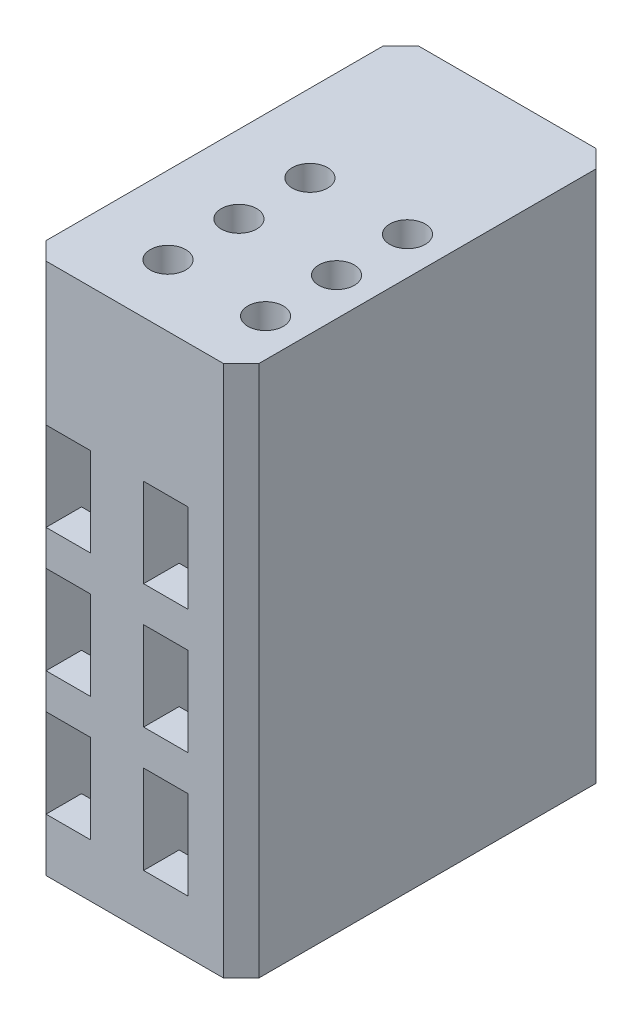
from build123d import *

# Parameters (mm, degrees)
EXTRUDE_1_DEPTH                  = 30
SKETCH_2_W                       = 4.5
SKETCH_2_H                       = 17
SKETCH_2_R                       = 1
EXTRUDE_2_DEPTH                  = 3
EXTRUDE_3_DEPTH                  = 27
PATTERN_LINEAR_1_COUNT           = 2
PATTERN_LINEAR_1_PITCH           = 5.5
PATTERN_LINEAR_2_COUNT           = 2
PATTERN_LINEAR_2_PITCH           = 5.5
CUT_EXTRUDE_1_REACH              = 39.108
SKETCH_5_W                       = 2.5
SKETCH_5_H                       = 3
PATTERN_LINEAR_3_COUNT           = 3
PATTERN_LINEAR_3_PITCH           = 7
PATTERN_LINEAR_4_COUNT           = 2
PATTERN_LINEAR_4_PITCH           = 5.5
PATTERN_LINEAR_4_COPY_1_REACH    = 39.108
PATTERN_LINEAR_4_COPY_1_SKETCH_W = 2.5
PATTERN_LINEAR_4_COPY_1_SKETCH_H = 3
PATTERN_LINEAR_4_COPY_2_REACH    = 39.108
PATTERN_LINEAR_4_COPY_2_SKETCH_W = 2.5
PATTERN_LINEAR_4_COPY_2_SKETCH_H = 3
CUT_EXTRUDE_2_REACH              = 39.108
SKETCH_6_W                       = 2.5
SKETCH_6_H                       = 5
PATTERN_LINEAR_5_COUNT           = 3
PATTERN_LINEAR_5_PITCH           = 7
PATTERN_LINEAR_7_COUNT           = 2
PATTERN_LINEAR_7_PITCH           = 5.5
PATTERN_LINEAR_7_COPY_1_REACH    = 39.108
PATTERN_LINEAR_7_COPY_1_SKETCH_W = 2.5
PATTERN_LINEAR_7_COPY_1_SKETCH_H = 5
PATTERN_LINEAR_7_COPY_2_REACH    = 39.108
PATTERN_LINEAR_7_COPY_2_SKETCH_W = 2.5
PATTERN_LINEAR_7_COPY_2_SKETCH_H = 5


with BuildPart() as part:
    # Эскиз1 → Бобышка-Вытянуть1 (new body)
    with BuildSketch(Plane(origin=(0, 0, 0), x_dir=(1, 0, 0), z_dir=(0, 1, 0))):
        Polygon((5, 0), (-5, 0), (-6, 1), (-6, 10.5), (-5, 10.5), (-5, 2), (-0.5, 2), (-0.5, 10.5), (0.5, 10.5), (0.5, 2), (5, 2), (5, 10.5), (6, 10.5), (6, 1), align=None)
    extrude_1 = extrude(amount=EXTRUDE_1_DEPTH)

    # Зеркальное отражение1: Бобышка-Вытянуть1 across plane
    add(extrude_1.mirror(Plane(origin=(-0.5, 30, -10.5), x_dir=(1, 0, 0), z_dir=(0, 0, 1))))

    # Эскиз2 → Бобышка-Вытянуть2 (add)
    with BuildSketch(Plane(origin=(0, 30, 0), x_dir=(1, 0, 0), z_dir=(0, 1, 0))):
        with Locations((-2.75, 10.5)):
            Rectangle(SKETCH_2_W, SKETCH_2_H)
        with Locations(Location((-1.625, 11.5, 0), (0, 0, 270))):
            Circle(SKETCH_2_R, mode=Mode.SUBTRACT)
        with Locations(Location((-1.625, 7.5, 0), (0, 0, 270))):
            Circle(SKETCH_2_R, mode=Mode.SUBTRACT)
        with Locations(Location((-1.625, 3.5, 0), (0, 0, 270))):
            Circle(SKETCH_2_R, mode=Mode.SUBTRACT)
    extrude_2 = extrude(amount=-EXTRUDE_2_DEPTH)

    # Эскиз3 → Бобышка-Вытянуть3 (add)
    with BuildSketch(Plane.XZ.offset(-27)):
        Polygon((-2.5, -19), (-0.5, -19), (-0.5, -13), (-1.625, -13), (-2.5, -13), align=None)
        Polygon((-1.625, -10), (-0.5, -10), (-0.5, -9), (-1.625, -9), (-2.5, -9), (-2.5, -10), align=None)
        Polygon((-1.625, -6), (-0.5, -6), (-0.5, -5), (-2.5, -5), (-2.5, -6), align=None)
    extrude_3 = extrude(amount=EXTRUDE_3_DEPTH)

    # Линейный массив1: Бобышка-Вытянуть2 ×2
    with Locations(*[(i * PATTERN_LINEAR_1_PITCH, 0, 0) for i in range(1, PATTERN_LINEAR_1_COUNT)]):
        add(extrude_2)

    # Линейный массив2: Бобышка-Вытянуть3 ×2
    with Locations(*[(i * PATTERN_LINEAR_2_PITCH, 0, 0) for i in range(1, PATTERN_LINEAR_2_COUNT)]):
        add(extrude_3)

    # Эскиз5 → Вырез-Вытянуть1 (cut, up to next)
    with BuildSketch(Plane(origin=(0, 0, -21), x_dir=(-1, 0, 0), z_dir=(0, 0, -1)), mode=Mode.PRIVATE) as cut_extrude_1_sk1:
        with Locations((3.75, 18.5)):
            Rectangle(SKETCH_5_W, SKETCH_5_H)
    cut_extrude_1_tool1 = extrude(cut_extrude_1_sk1.sketch, amount=-CUT_EXTRUDE_1_REACH, mode=Mode.PRIVATE) & part.part
    cut_extrude_1 = cut_extrude_1_tool1.solids().sort_by_distance((-3.75, 18.5, -21))[0]
    add(cut_extrude_1, mode=Mode.SUBTRACT)

    # Линейный массив3: Вырез-Вытянуть1 ×3
    with Locations(*[(0, -i * PATTERN_LINEAR_3_PITCH, 0) for i in range(1, PATTERN_LINEAR_3_COUNT)]):
        add(cut_extrude_1, mode=Mode.SUBTRACT)

    # Линейный массив4: Вырез-Вытянуть1 ×2
    with Locations(*[(i * PATTERN_LINEAR_4_PITCH, 0, 0) for i in range(1, PATTERN_LINEAR_4_COUNT)]):
        add(cut_extrude_1, mode=Mode.SUBTRACT)

    # Линейный массив4 copy 1 sketch → Линейный массив4 copy 1 (cut, up to next)
    with BuildSketch(Plane(origin=(5.5, -7, -21), x_dir=(-1, 0, 0), z_dir=(0, 0, -1)), mode=Mode.PRIVATE) as pattern_linear_4_copy_1_sk1:
        with Locations((3.75, 18.5)):
            Rectangle(PATTERN_LINEAR_4_COPY_1_SKETCH_W, PATTERN_LINEAR_4_COPY_1_SKETCH_H)
    pattern_linear_4_copy_1_tool1 = extrude(pattern_linear_4_copy_1_sk1.sketch, amount=-PATTERN_LINEAR_4_COPY_1_REACH, mode=Mode.PRIVATE) & part.part
    add(pattern_linear_4_copy_1_tool1.solids().sort_by_distance((1.75, 11.5, -21))[0], mode=Mode.SUBTRACT)

    # Линейный массив4 copy 2 sketch → Линейный массив4 copy 2 (cut, up to next)
    with BuildSketch(Plane(origin=(5.5, -14, -21), x_dir=(-1, 0, 0), z_dir=(0, 0, -1)), mode=Mode.PRIVATE) as pattern_linear_4_copy_2_sk1:
        with Locations((3.75, 18.5)):
            Rectangle(PATTERN_LINEAR_4_COPY_2_SKETCH_W, PATTERN_LINEAR_4_COPY_2_SKETCH_H)
    pattern_linear_4_copy_2_tool1 = extrude(pattern_linear_4_copy_2_sk1.sketch, amount=-PATTERN_LINEAR_4_COPY_2_REACH, mode=Mode.PRIVATE) & part.part
    add(pattern_linear_4_copy_2_tool1.solids().sort_by_distance((1.75, 4.5, -21))[0], mode=Mode.SUBTRACT)

    # Эскиз6 → Вырез-Вытянуть2 (cut, up to next)
    with BuildSketch(Plane.XY, mode=Mode.PRIVATE) as cut_extrude_2_sk1:
        with Locations((-3.75, 19.5)):
            Rectangle(SKETCH_6_W, SKETCH_6_H)
    cut_extrude_2_tool1 = extrude(cut_extrude_2_sk1.sketch, amount=-CUT_EXTRUDE_2_REACH, mode=Mode.PRIVATE) & part.part
    cut_extrude_2 = cut_extrude_2_tool1.solids().sort_by_distance((-3.75, 19.5, 0))[0]
    add(cut_extrude_2, mode=Mode.SUBTRACT)

    # Линейный массив5: Вырез-Вытянуть2 ×3
    with Locations(*[(0, -i * PATTERN_LINEAR_5_PITCH, 0) for i in range(1, PATTERN_LINEAR_5_COUNT)]):
        add(cut_extrude_2, mode=Mode.SUBTRACT)

    # Линейный массив7: Вырез-Вытянуть2 ×2
    with Locations(*[(i * PATTERN_LINEAR_7_PITCH, 0, 0) for i in range(1, PATTERN_LINEAR_7_COUNT)]):
        add(cut_extrude_2, mode=Mode.SUBTRACT)

    # Линейный массив7 copy 1 sketch → Линейный массив7 copy 1 (cut, up to next)
    with BuildSketch(Plane(origin=(5.5, -7, 0), x_dir=(1, 0, 0), z_dir=(0, 0, 1)), mode=Mode.PRIVATE) as pattern_linear_7_copy_1_sk1:
        with Locations((-3.75, 19.5)):
            Rectangle(PATTERN_LINEAR_7_COPY_1_SKETCH_W, PATTERN_LINEAR_7_COPY_1_SKETCH_H)
    pattern_linear_7_copy_1_tool1 = extrude(pattern_linear_7_copy_1_sk1.sketch, amount=-PATTERN_LINEAR_7_COPY_1_REACH, mode=Mode.PRIVATE) & part.part
    add(pattern_linear_7_copy_1_tool1.solids().sort_by_distance((1.75, 12.5, 0))[0], mode=Mode.SUBTRACT)

    # Линейный массив7 copy 2 sketch → Линейный массив7 copy 2 (cut, up to next)
    with BuildSketch(Plane(origin=(5.5, -14, 0), x_dir=(1, 0, 0), z_dir=(0, 0, 1)), mode=Mode.PRIVATE) as pattern_linear_7_copy_2_sk1:
        with Locations((-3.75, 19.5)):
            Rectangle(PATTERN_LINEAR_7_COPY_2_SKETCH_W, PATTERN_LINEAR_7_COPY_2_SKETCH_H)
    pattern_linear_7_copy_2_tool1 = extrude(pattern_linear_7_copy_2_sk1.sketch, amount=-PATTERN_LINEAR_7_COPY_2_REACH, mode=Mode.PRIVATE) & part.part
    add(pattern_linear_7_copy_2_tool1.solids().sort_by_distance((1.75, 5.5, 0))[0], mode=Mode.SUBTRACT)


solid = part.part
